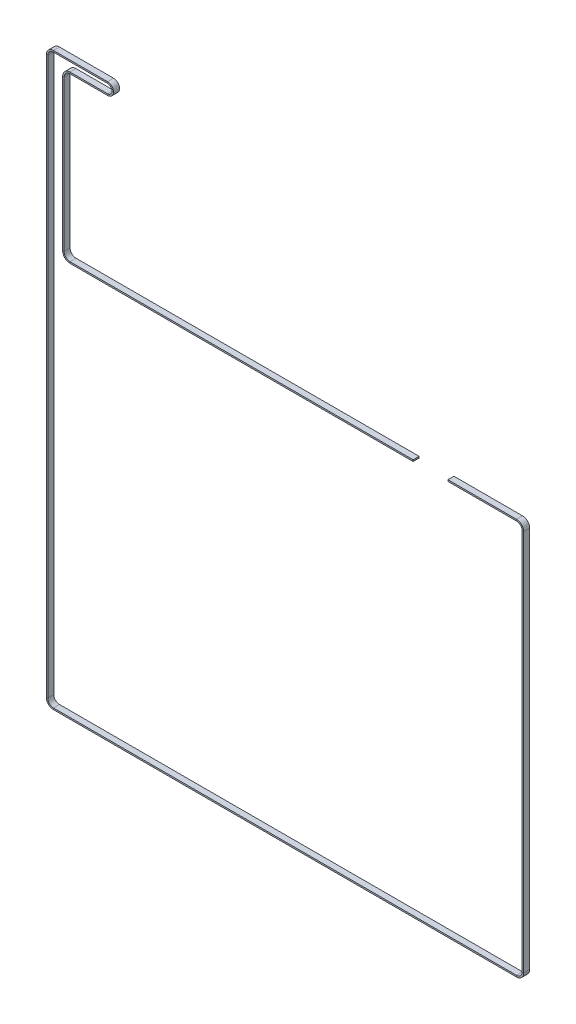
from build123d import *

# Parameters (mm, degrees)
SKETCH2_W = 6
SKETCH2_H = 1.5


with BuildPart() as part:
    # Sweep1: sweep along a path in Sketch1
    with BuildLine(Plane(origin=(0, -21, 4.45), x_dir=(1, 0, 0), z_dir=(0, 0, 1))) as sweep1_path:
        Line((387.055629223, -100.396518349), (455.5, -100.396518349))
        ThreePointArc((455.5, -100.396518349), (460.007801717, -102.263710937), (461.874994371, -106.771512626))
        Line((461.874994371, -106.771512626), (461.875, -488))
        ThreePointArc((461.875, -488), (460.00780573, -492.50780573), (455.5, -494.375))
        Line((455.5, -494.375), (-6.5, -494.375))
        ThreePointArc((-6.5, -494.375), (-11.00780573, -492.50780573), (-12.875, -488))
        Line((-12.875, -488), (-12.875, 67.325))
        ThreePointArc((-12.875, 67.325), (-11.00780573, 71.83280573), (-6.5, 73.7))
        Line((-6.5, 73.7), (47.5, 73.7))
        ThreePointArc((47.5, 73.7), (52.7, 68.5), (47.5, 63.3))
        Line((47.5, 63.3), (10, 63.3))
        ThreePointArc((10, 63.3), (5.333095244, 61.366904756), (3.4, 56.7))
        Line((3.4, 56.7), (3.4, -93.946518349))
        ThreePointArc((3.4, -93.946518349), (5.333095244, -98.613423105), (10, -100.546518349))
        Line((10, -100.546518349), (352.355629223, -100.546518349))
    # Sketch2 → Sweep1 (sweep)
    with BuildSketch(Plane(origin=(387.055629223, -121.396518349, 4.45), x_dir=(0, 0, 1), z_dir=(-1, 0, 0))):
        Rectangle(SKETCH2_W, SKETCH2_H)
    sweep(path=sweep1_path.line)


solid = part.part
